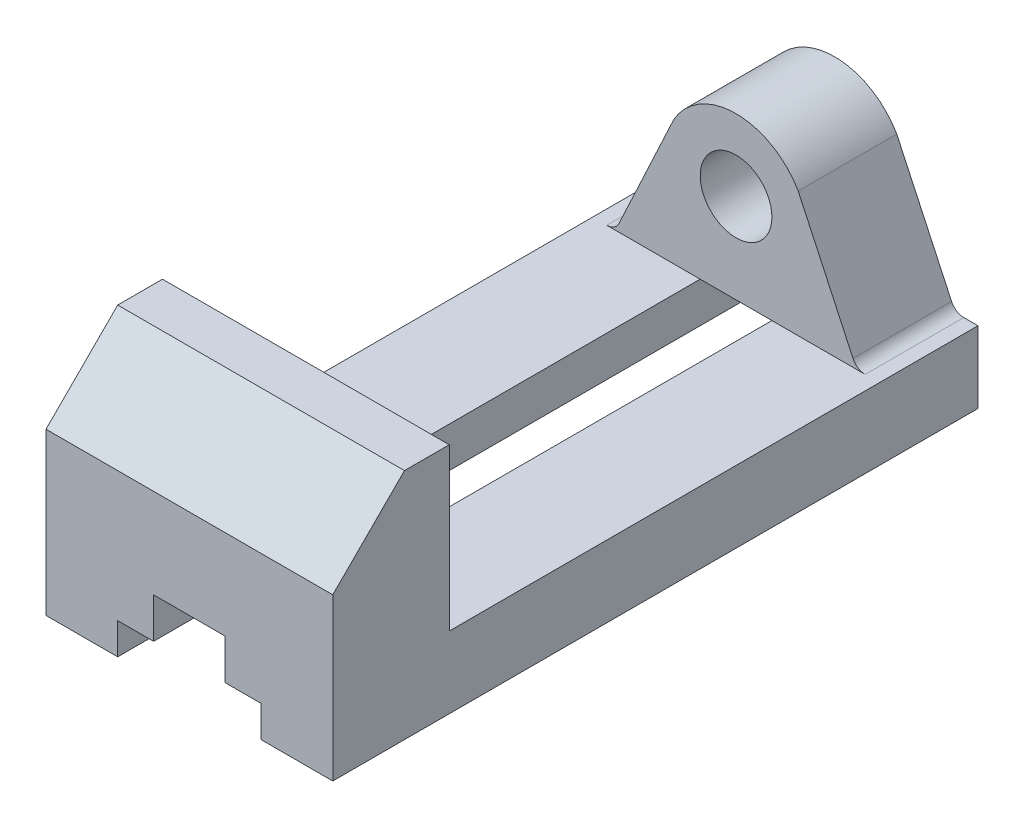
from build123d import *

# Parameters (mm, degrees)
BOSS_EXTRUDE1_DEPTH             = 32
SKETCH3_R                       = 8
BOSS_EXTRUDE2_DEPTH             = 22
M6X1_0_TAPPED_HOLE2_D           = 5
M6X1_0_TAPPED_HOLE2_DEPTH       = 10
M6X1_0_TAPPED_HOLE2_CSINK_D     = 6.05
M6X1_0_TAPPED_HOLE2_CSINK_ANGLE = 100
M6X1_0_TAPPED_HOLE2_TIP         = 1.502151548
CUT_EXTRUDE3_DEPTH              = 157.409718368
FILLET1_R                       = 3


with BuildPart() as part:
    # Sketch1 → Boss-Extrude1 (new, symmetric)
    with BuildSketch(Plane(origin=(0, 0, 0), x_dir=(0, 0, -1), z_dir=(1, 0, 0))):
        Polygon((0, 0), (0, 16), (-118, 16), (-118, 52), (-128, 52), (-144, 36), (-144, 0), align=None)
    extrude(amount=BOSS_EXTRUDE1_DEPTH, both=True)

    # Sketch3 → Boss-Extrude2 (add)
    with BuildSketch(Plane.XY):
        with BuildLine():
            Line((26.915706543, 16), (13.870490741, 43.975555567))
            ThreePointArc((13.870490741, 43.975555567), (0, 52), (-13.870490741, 43.975555567))
            Line((-13.870490741, 43.975555567), (-26.915706543, 16))
            Line((-26.915706543, 16), (26.915706543, 16))
        make_face()
        with Locations((0, 36)):
            Circle(SKETCH3_R, mode=Mode.SUBTRACT)
    extrude(amount=BOSS_EXTRUDE2_DEPTH)

    # M6x1.0 Tapped Hole2
    with Locations(Plane(origin=(0, 0, 0), x_dir=(-1, 0, 0), z_dir=(0, -1, 0))):
        with Locations((22, -38), (22, -108), (-22, -108), (-22, -38)):
            CounterSinkHole(M6X1_0_TAPPED_HOLE2_D / 2, M6X1_0_TAPPED_HOLE2_CSINK_D / 2, depth=M6X1_0_TAPPED_HOLE2_DEPTH, counter_sink_angle=M6X1_0_TAPPED_HOLE2_CSINK_ANGLE)
            with Locations((0, 0, -(M6X1_0_TAPPED_HOLE2_DEPTH + M6X1_0_TAPPED_HOLE2_TIP / 2))):  # 118° drill point
                Cone(0, M6X1_0_TAPPED_HOLE2_D / 2, M6X1_0_TAPPED_HOLE2_TIP, mode=Mode.SUBTRACT)

    # Sketch11 → Cut-Extrude3 (cut, through all)
    with BuildSketch(Plane.XY):
        Polygon((-16, 0), (-16, 7), (-8, 7), (-8, 16), (8, 16), (8, 7), (16, 7), (16, 0), (16, -2.333902057), (-16, -2.333902057), align=None)
    extrude(amount=CUT_EXTRUDE3_DEPTH, mode=Mode.SUBTRACT)

    # Fillet1
    fillet1_edges = [part.edges().sort_by_distance(p)[0] for p in [
        (-26.915706543, 16, 11),
        (26.915706543, 16, 11),
    ]]
    fillet(fillet1_edges, radius=FILLET1_R)


solid = part.part
